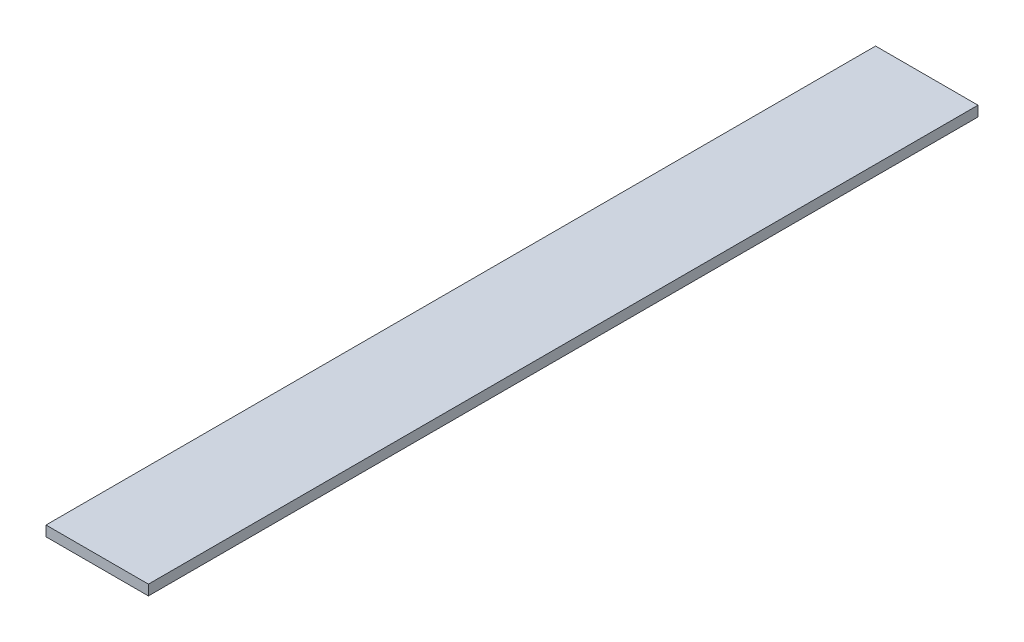
from build123d import *

# Parameters (mm, degrees)
SKETCH1_W      = 50
SKETCH1_H      = 405
EXTRUDE1_DEPTH = 5


with BuildPart() as part:
    # Sketch1 → Extrude1 (new body)
    with BuildSketch(Plane(origin=(0, 0, 0), x_dir=(1, 0, 0), z_dir=(0, 1, 0))):
        Rectangle(SKETCH1_W, SKETCH1_H)
    extrude(amount=EXTRUDE1_DEPTH)


solid = part.part
